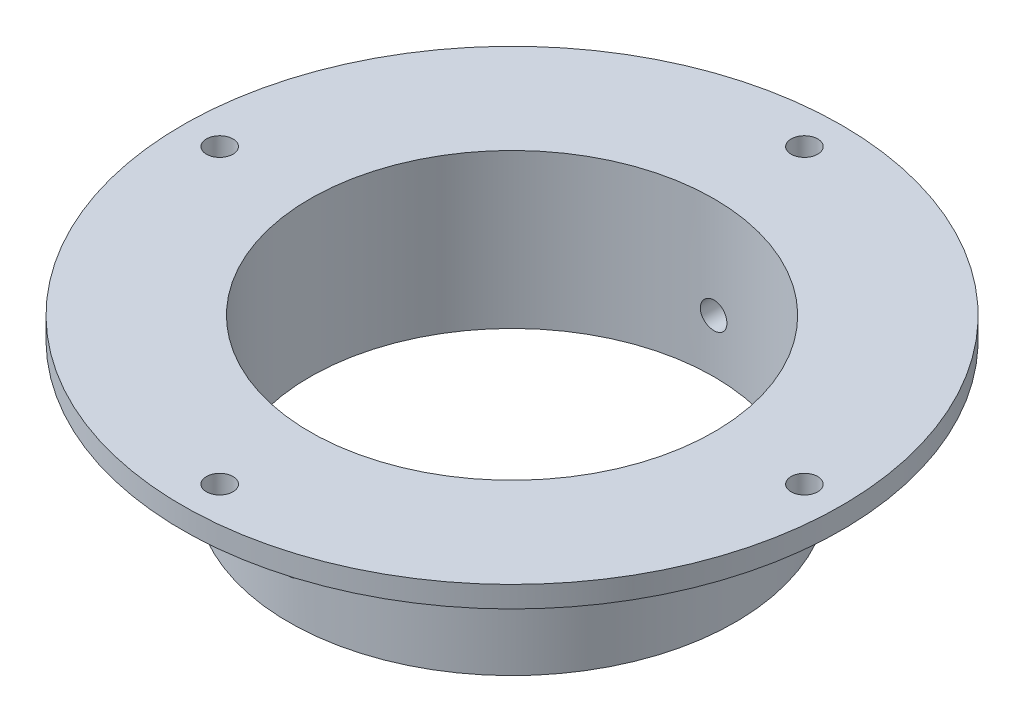
from build123d import *

# Parameters (mm, degrees)
SKETCH2_R               = 2.5
CUT_EXTRUDE3_DEPTH      = 92.175654645
CUT_EXTRUDE6_DEPTH      = 93.352585237
CUT_EXTRUDE6_DEPTH_BACK = 93.352585237
SKETCH6_R               = 2.5


with BuildPart() as part:
    # Sketch1 → Revolve1 (revolve)
    with BuildSketch(Plane.XY, mode=Mode.PRIVATE) as revolve1_sk:
        Polygon((-42, -29), (-42, -4), (-62, -4), (-62, 0), (-38, 0), (-38, -29), align=None)
    revolve(revolve1_sk.sketch.rotate(Axis((0, -100.5, 0), (0, 1, 0)), 270), axis=Axis((0, -100.5, 0), (0, 1, 0)))

    # Sketch2 → Cut-Extrude3 (cut, through all)
    with BuildSketch(Plane.XZ.offset(4)):
        with Locations(Location((55, 0, 0), (0, 0, 270))):
            Circle(SKETCH2_R)
        with Locations(Location((-55, 0, 0), (0, 0, 270))):
            Circle(SKETCH2_R)
        with Locations(Location((0, 55, 0), (0, 0, 270))):
            Circle(SKETCH2_R)
        with Locations(Location((0, -55, 0), (0, 0, 270))):
            Circle(SKETCH2_R)
    extrude(amount=-CUT_EXTRUDE3_DEPTH, mode=Mode.SUBTRACT)

    # Sketch6 → Cut-Extrude6 (cut, two sides: drawn at the far end of the back side and taken through both)
    with BuildSketch(Plane.XY.offset(-CUT_EXTRUDE6_DEPTH_BACK)):
        with Locations((0, -19)):
            Circle(SKETCH6_R)
    extrude(amount=CUT_EXTRUDE6_DEPTH + CUT_EXTRUDE6_DEPTH_BACK, mode=Mode.SUBTRACT)


solid = part.part
